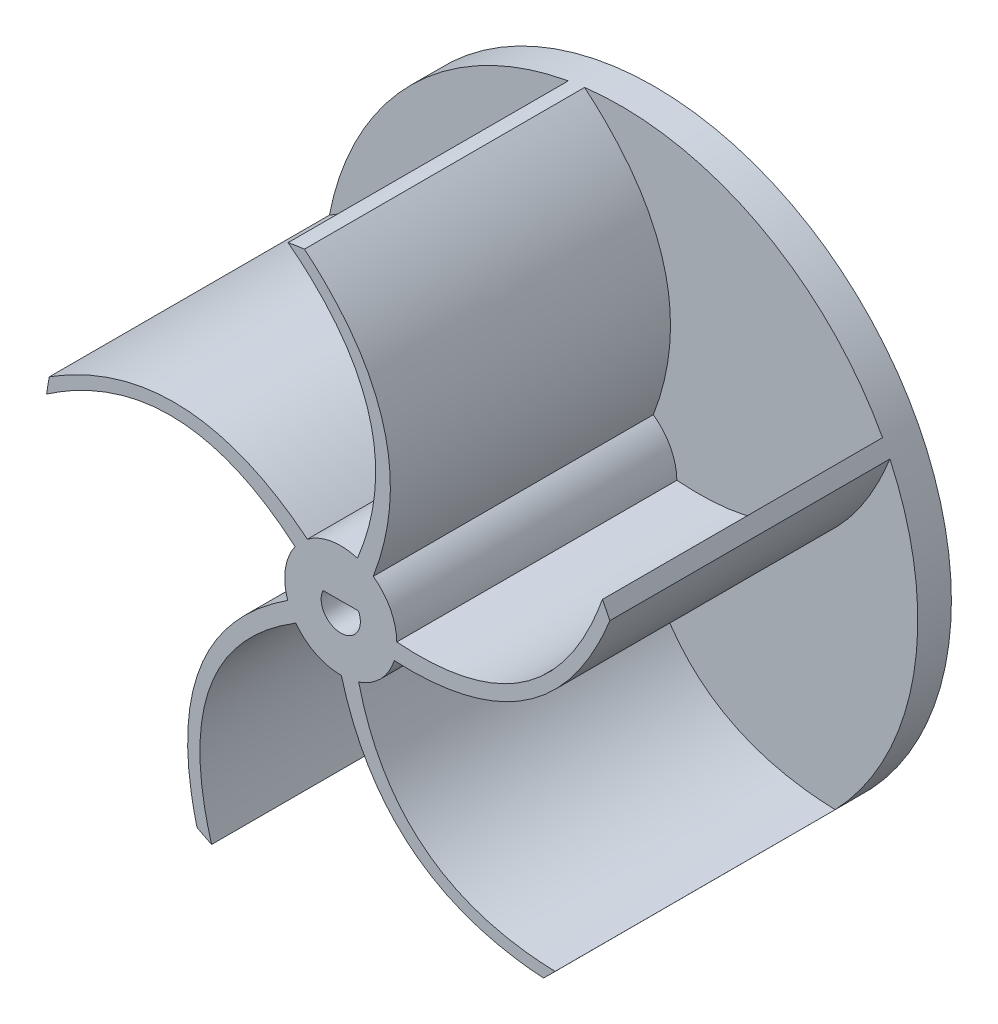
from build123d import *

# Parameters (mm, degrees)
SKETCH1_R           = 26.5
SKETCH1_R_2         = 1.75
BOSS_EXTRUDE1_DEPTH = 3
SKETCH2_R           = 5
SKETCH2_R_2         = 1.75
BOSS_EXTRUDE2_DEPTH = 25
BOSS_EXTRUDE3_START = -28
BOSS_EXTRUDE3_DEPTH = 28
BOSS_EXTRUDE4_DEPTH = 25
CIRPATTERN1_COUNT   = 5


with BuildPart() as part:
    # Sketch1 → Boss-Extrude1 (new body)
    with BuildSketch(Plane.XY):
        Circle(SKETCH1_R)
        Circle(SKETCH1_R_2, mode=Mode.SUBTRACT)
    extrude(amount=BOSS_EXTRUDE1_DEPTH)

    # Sketch2 → Boss-Extrude2 (add)
    with BuildSketch(Plane.XY.offset(3)):
        Circle(SKETCH2_R)
        Circle(SKETCH2_R_2, mode=Mode.SUBTRACT)
    extrude(amount=BOSS_EXTRUDE2_DEPTH)

    # Sketch3 → Boss-Extrude3 (add)
    with BuildSketch(Plane.XY.offset(28).offset(BOSS_EXTRUDE3_START)):
        with BuildLine():
            ThreePointArc((1.58113883, 0.75), (0, 1.75), (-1.58113883, 0.75))
            Line((-1.58113883, 0.75), (0, 0.75))
            Line((0, 0.75), (1.58113883, 0.75))
        make_face()
    extrude(amount=BOSS_EXTRUDE3_DEPTH)

    # Sketch4 → Boss-Extrude4 (add)
    with BuildSketch(Plane.XY.offset(3)):
        with BuildLine():
            ThreePointArc((1.491525209, 4.772352937), (2.221644371, 4.479318731), (2.89676068, 4.075386799))
            add(Edge.make_bspline(
                [(2.89676068, 4.075386799), (6.200814746, 12.743614818), (4.154792704, 20.152161031), (-3.241305446, 26.301025436)],
                knots=[0.132924517, 0.132924517, 0.132924517, 0.132924517, 1, 1, 1, 1], degree=3))
            ThreePointArc((-3.241305446, 26.301025436), (-3.970865914, 26.200805787), (-4.697359939, 26.080352943))
            add(Edge.make_bspline(
                [(1.491525209, 4.772352937), (4.947392891, 13.120869253), (2.884431175, 20.223535921), (-4.697359939, 26.080352943)],
                knots=[0.156414662, 0.156414662, 0.156414662, 0.156414662, 1, 1, 1, 1], degree=3))
        make_face()
    boss_extrude4 = extrude(amount=BOSS_EXTRUDE4_DEPTH)

    # CirPattern1: Boss-Extrude4 ×5 about axis
    cirpattern1_axis = Axis((0, 0, 0), (0, 0, -1))
    for i in range(1, CIRPATTERN1_COUNT):
        add(boss_extrude4.rotate(cirpattern1_axis, i * 360 / CIRPATTERN1_COUNT))


solid = part.part
